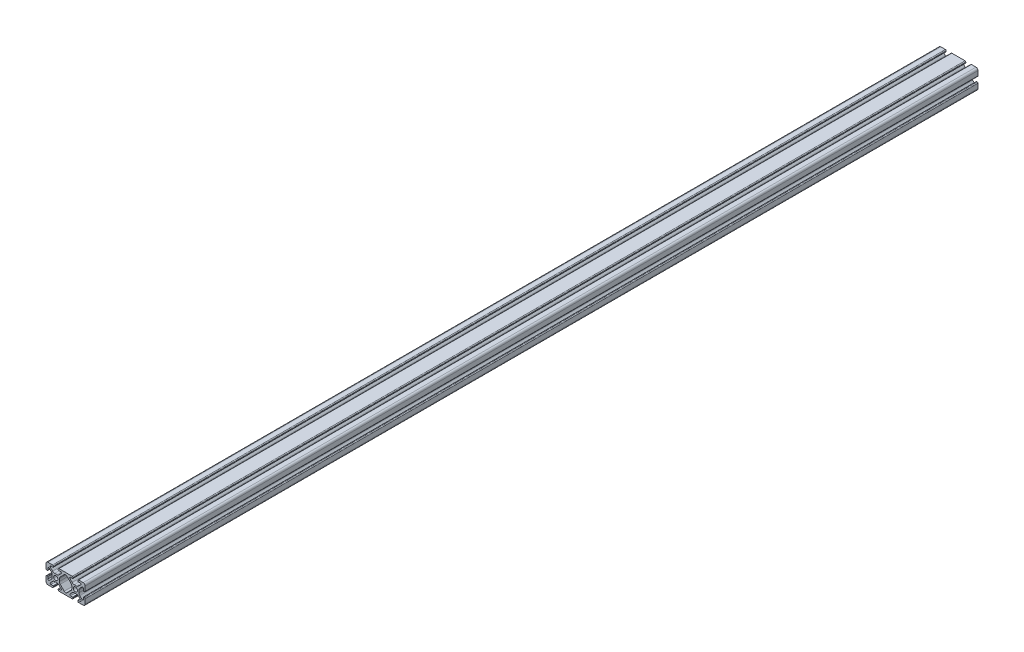
from build123d import *

# Parameters (mm, degrees)
ESQUISSE1_R        = 2.15
BOSS_EXTRU_1_DEPTH = 456


with BuildPart() as part:
    # Esquisse1 → Boss.-Extru.1 (new, symmetric)
    with BuildSketch(Plane(origin=(0, 0, 0), x_dir=(-1, 0, 0), z_dir=(0, 0, -1))):
        with BuildLine():
            Line((-40, 6.7), (-40, 2))
            ThreePointArc((-40, 2), (-39.414213562, 0.585786438), (-38, 0))
            Line((-38, 0), (-33.3, 0))
            ThreePointArc((-33.3, 0), (-32.734314575, 0.234314575), (-32.5, 0.8))
            Line((-32.5, 0.8), (-32.5, 1.5))
            ThreePointArc((-32.5, 1.5), (-32.587867966, 1.712132034), (-32.8, 1.8))
            Line((-32.8, 1.8), (-34.918424061, 1.8))
            ThreePointArc((-34.918424061, 1.8), (-35.686700051, 2.313345604), (-35.506437047, 3.219588924))
            Line((-35.506437047, 3.219588924), (-33.254705627, 5.471320344))
            ThreePointArc((-33.254705627, 5.471320344), (-32.281435581, 6.121638598), (-31.133385284, 6.35))
            Line((-31.133385284, 6.35), (-28.866614716, 6.35))
            ThreePointArc((-28.866614716, 6.35), (-27.718564419, 6.121638598), (-26.745294373, 5.471320344))
            Line((-26.745294373, 5.471320344), (-24.493562953, 3.219588924))
            ThreePointArc((-24.493562953, 3.219588924), (-24.313299949, 2.313345604), (-25.081575939, 1.8))
            Line((-25.081575939, 1.8), (-27.2, 1.8))
            ThreePointArc((-27.2, 1.8), (-27.412132034, 1.712132034), (-27.5, 1.5))
            Line((-27.5, 1.5), (-27.5, 0.8))
            ThreePointArc((-27.5, 0.8), (-27.265685425, 0.234314575), (-26.7, 0))
            Line((-26.7, 0), (-13.3, 0))
            ThreePointArc((-13.3, 0), (-12.734314575, 0.234314575), (-12.5, 0.8))
            Line((-12.5, 0.8), (-12.5, 1.5))
            ThreePointArc((-12.5, 1.5), (-12.587867966, 1.712132034), (-12.8, 1.8))
            Line((-12.8, 1.8), (-14.918424061, 1.8))
            ThreePointArc((-14.918424061, 1.8), (-15.686700051, 2.313345604), (-15.506437047, 3.219588924))
            Line((-15.506437047, 3.219588924), (-13.254705627, 5.471320344))
            ThreePointArc((-13.254705627, 5.471320344), (-12.281435581, 6.121638598), (-11.133385284, 6.35))
            Line((-11.133385284, 6.35), (-8.866614716, 6.35))
            ThreePointArc((-8.866614716, 6.35), (-7.718564419, 6.121638598), (-6.745294373, 5.471320344))
            Line((-6.745294373, 5.471320344), (-4.493562953, 3.219588924))
            ThreePointArc((-4.493562953, 3.219588924), (-4.313299949, 2.313345604), (-5.081575939, 1.8))
            Line((-5.081575939, 1.8), (-7.2, 1.8))
            ThreePointArc((-7.2, 1.8), (-7.412132034, 1.712132034), (-7.5, 1.5))
            Line((-7.5, 1.5), (-7.5, 0.8))
            ThreePointArc((-7.5, 0.8), (-7.265685425, 0.234314575), (-6.7, 0))
            Line((-6.7, 0), (-2, 0))
            ThreePointArc((-2, 0), (-0.585786438, 0.585786438), (0, 2))
            Line((0, 2), (0, 6.7))
            ThreePointArc((0, 6.7), (-0.234314575, 7.265685425), (-0.8, 7.5))
            Line((-0.8, 7.5), (-1.5, 7.5))
            ThreePointArc((-1.5, 7.5), (-1.712132034, 7.412132034), (-1.8, 7.2))
            Line((-1.8, 7.2), (-1.8, 5.081575939))
            ThreePointArc((-1.8, 5.081575939), (-2.313345604, 4.313299949), (-3.219588924, 4.493562953))
            Line((-3.219588924, 4.493562953), (-5.471320344, 6.745294373))
            ThreePointArc((-5.471320344, 6.745294373), (-6.121638598, 7.718564419), (-6.35, 8.866614716))
            Line((-6.35, 8.866614716), (-6.35, 11.133385284))
            ThreePointArc((-6.35, 11.133385284), (-6.121638598, 12.281435581), (-5.471320344, 13.254705627))
            Line((-5.471320344, 13.254705627), (-3.219588924, 15.506437047))
            ThreePointArc((-3.219588924, 15.506437047), (-2.313345604, 15.686700051), (-1.8, 14.918424061))
            Line((-1.8, 14.918424061), (-1.8, 12.8))
            ThreePointArc((-1.8, 12.8), (-1.712132034, 12.587867966), (-1.5, 12.5))
            Line((-1.5, 12.5), (-0.8, 12.5))
            ThreePointArc((-0.8, 12.5), (-0.234314575, 12.734314575), (0, 13.3))
            Line((0, 13.3), (0, 18))
            ThreePointArc((0, 18), (-0.585786438, 19.414213562), (-2, 20))
            Line((-2, 20), (-6.7, 20))
            ThreePointArc((-6.7, 20), (-7.265685425, 19.765685425), (-7.5, 19.2))
            Line((-7.5, 19.2), (-7.5, 18.5))
            ThreePointArc((-7.5, 18.5), (-7.412132034, 18.287867966), (-7.2, 18.2))
            Line((-7.2, 18.2), (-5.081575939, 18.2))
            ThreePointArc((-5.081575939, 18.2), (-4.313299949, 17.686654396), (-4.493562953, 16.780411076))
            Line((-4.493562953, 16.780411076), (-6.745294373, 14.528679656))
            ThreePointArc((-6.745294373, 14.528679656), (-7.718564419, 13.878361402), (-8.866614716, 13.65))
            Line((-8.866614716, 13.65), (-11.133385284, 13.65))
            ThreePointArc((-11.133385284, 13.65), (-12.281435581, 13.878361402), (-13.254705627, 14.528679656))
            Line((-13.254705627, 14.528679656), (-15.506437047, 16.780411076))
            ThreePointArc((-15.506437047, 16.780411076), (-15.686700051, 17.686654396), (-14.918424061, 18.2))
            Line((-14.918424061, 18.2), (-12.8, 18.2))
            ThreePointArc((-12.8, 18.2), (-12.587867966, 18.287867966), (-12.5, 18.5))
            Line((-12.5, 18.5), (-12.5, 19.2))
            ThreePointArc((-12.5, 19.2), (-12.734314575, 19.765685425), (-13.3, 20))
            Line((-13.3, 20), (-26.7, 20))
            ThreePointArc((-26.7, 20), (-27.265685425, 19.765685425), (-27.5, 19.2))
            Line((-27.5, 19.2), (-27.5, 18.5))
            ThreePointArc((-27.5, 18.5), (-27.412132034, 18.287867966), (-27.2, 18.2))
            Line((-27.2, 18.2), (-25.081575939, 18.2))
            ThreePointArc((-25.081575939, 18.2), (-24.313299949, 17.686654396), (-24.493562953, 16.780411076))
            Line((-24.493562953, 16.780411076), (-26.745294373, 14.528679656))
            ThreePointArc((-26.745294373, 14.528679656), (-27.718564419, 13.878361402), (-28.866614716, 13.65))
            Line((-28.866614716, 13.65), (-31.133385284, 13.65))
            ThreePointArc((-31.133385284, 13.65), (-32.281435581, 13.878361402), (-33.254705627, 14.528679656))
            Line((-33.254705627, 14.528679656), (-35.506437047, 16.780411076))
            ThreePointArc((-35.506437047, 16.780411076), (-35.686700051, 17.686654396), (-34.918424061, 18.2))
            Line((-34.918424061, 18.2), (-32.8, 18.2))
            ThreePointArc((-32.8, 18.2), (-32.587867966, 18.287867966), (-32.5, 18.5))
            Line((-32.5, 18.5), (-32.5, 19.2))
            ThreePointArc((-32.5, 19.2), (-32.734314575, 19.765685425), (-33.3, 20))
            Line((-33.3, 20), (-38, 20))
            ThreePointArc((-38, 20), (-39.414213562, 19.414213562), (-40, 18))
            Line((-40, 18), (-40, 13.3))
            ThreePointArc((-40, 13.3), (-39.765685425, 12.734314575), (-39.2, 12.5))
            Line((-39.2, 12.5), (-38.5, 12.5))
            ThreePointArc((-38.5, 12.5), (-38.287867966, 12.587867966), (-38.2, 12.8))
            Line((-38.2, 12.8), (-38.2, 14.918424061))
            ThreePointArc((-38.2, 14.918424061), (-37.686654396, 15.686700051), (-36.780411076, 15.506437047))
            Line((-36.780411076, 15.506437047), (-34.528679656, 13.254705627))
            ThreePointArc((-34.528679656, 13.254705627), (-33.878361402, 12.281435581), (-33.65, 11.133385284))
            Line((-33.65, 11.133385284), (-33.65, 8.866614716))
            ThreePointArc((-33.65, 8.866614716), (-33.878361402, 7.718564419), (-34.528679656, 6.745294373))
            Line((-34.528679656, 6.745294373), (-36.780411076, 4.493562953))
            ThreePointArc((-36.780411076, 4.493562953), (-37.686654396, 4.313299949), (-38.2, 5.081575939))
            Line((-38.2, 5.081575939), (-38.2, 7.2))
            ThreePointArc((-38.2, 7.2), (-38.287867966, 7.412132034), (-38.5, 7.5))
            Line((-38.5, 7.5), (-39.2, 7.5))
            ThreePointArc((-39.2, 7.5), (-39.765685425, 7.265685425), (-40, 6.7))
        make_face()
        with Locations((-10, 10)):
            Circle(ESQUISSE1_R, mode=Mode.SUBTRACT)
        with Locations((-30, 10)):
            Circle(ESQUISSE1_R, mode=Mode.SUBTRACT)
        with BuildLine():
            Line((-18.585786174, 17.312993861), (-14.528681072, 13.255889759))
            ThreePointArc((-14.528681072, 13.255889759), (-13.878362627, 12.282619622), (-13.650001154, 11.134569154))
            Line((-13.650001154, 11.134569154), (-13.650001154, 8.865431094))
            ThreePointArc((-13.650001154, 8.865431094), (-13.878362476, 7.717381202), (-14.5286805, 6.7441115))
            Line((-14.5286805, 6.7441115), (-18.585786, 2.687006))
            ThreePointArc((-18.585786, 2.687006), (-19.999999562, 2.101219562), (-21.414213125, 2.687006))
            Line((-21.414213125, 2.687006), (-25.471320125, 6.744113))
            ThreePointArc((-25.471320125, 6.744113), (-26.121638379, 7.717383046), (-26.349999781, 8.865433344))
            Line((-26.349999781, 8.865433344), (-26.349999781, 11.134567344))
            ThreePointArc((-26.349999781, 11.134567344), (-26.121638308, 12.282617811), (-25.471319863, 13.255887949))
            Line((-25.471319863, 13.255887949), (-21.41421295, 17.312993861))
            ThreePointArc((-21.41421295, 17.312993861), (-19.999999562, 17.898780125), (-18.585786174, 17.312993861))
        make_face(mode=Mode.SUBTRACT)
    extrude(amount=BOSS_EXTRU_1_DEPTH, both=True)


solid = part.part
